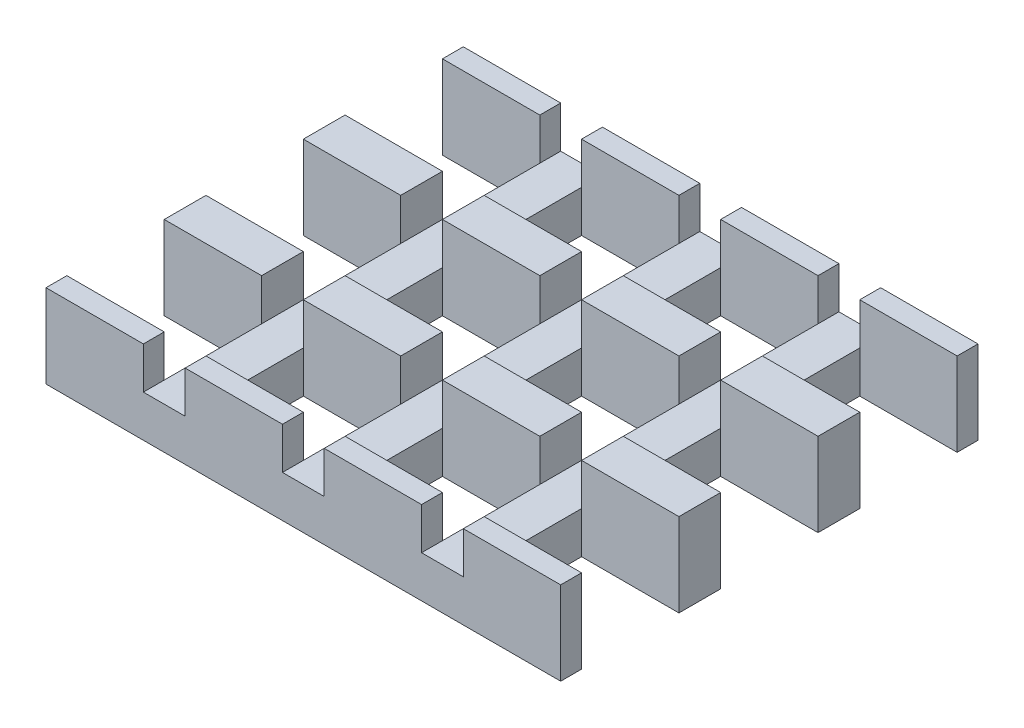
from build123d import *

# Parameters (mm, degrees)
SKETCH6_W            = 40
SKETCH6_H            = 30
BOSS_EXTRUDE1_DEPTH  = 6
SKETCH10_W           = 7
SKETCH10_H           = 7
CUT_EXTRUDE6_DEPTH   = 51.358713248
LPATTERN3_COUNT      = 3
LPATTERN3_PITCH      = 10
LPATTERN3_COUNT_DIR2 = 4
LPATTERN3_PITCH_DIR2 = 10
SKETCH11_W           = 3
SKETCH11_H           = 30
CUT_EXTRUDE7_DEPTH   = 3
LPATTERN4_COUNT      = 3
LPATTERN4_PITCH      = 10
SKETCH12_W           = 1.5
SKETCH12_H           = 30
CUT_EXTRUDE8_DEPTH   = 51.358713248


with BuildPart() as part:
    # Sketch6 → Boss-Extrude1 (new body)
    with BuildSketch(Plane(origin=(0, 0, 0), x_dir=(1, 0, 0), z_dir=(0, 1, 0))):
        with Locations((20, -15)):
            Rectangle(SKETCH6_W, SKETCH6_H)
    extrude(amount=BOSS_EXTRUDE1_DEPTH)

    # Sketch10 → Cut-Extrude6 (cut, through all)
    with BuildSketch(Plane(origin=(0, 6, 0), x_dir=(1, 0, 0), z_dir=(0, 1, 0))):
        with Locations((5, -5)):
            Rectangle(SKETCH10_W, SKETCH10_H)
    cut_extrude6 = extrude(amount=-CUT_EXTRUDE6_DEPTH, mode=Mode.SUBTRACT)

    # LPattern3: Cut-Extrude6 3 × 4
    with Locations(*[(j * LPATTERN3_PITCH_DIR2, 0, i * LPATTERN3_PITCH) for i in range(LPATTERN3_COUNT) for j in range(LPATTERN3_COUNT_DIR2) if (i, j) != (0, 0)]):
        add(cut_extrude6, mode=Mode.SUBTRACT)

    # Sketch11 → Cut-Extrude7 (cut)
    with BuildSketch(Plane(origin=(0, 6, 0), x_dir=(1, 0, 0), z_dir=(0, 1, 0))):
        with Locations((10, -15)):
            Rectangle(SKETCH11_W, SKETCH11_H)
    cut_extrude7 = extrude(amount=-CUT_EXTRUDE7_DEPTH, mode=Mode.SUBTRACT)

    # LPattern4: Cut-Extrude7 ×3
    with Locations(*[(i * LPATTERN4_PITCH, 0, 0) for i in range(1, LPATTERN4_COUNT)]):
        add(cut_extrude7, mode=Mode.SUBTRACT)

    # Sketch12 → Cut-Extrude8 (cut, through all)
    with BuildSketch(Plane(origin=(0, 6, 0), x_dir=(1, 0, 0), z_dir=(0, 1, 0))):
        with Locations((0.75, -15)):
            Rectangle(SKETCH12_W, SKETCH12_H)
        with Locations((39.25, -15)):
            Rectangle(SKETCH12_W, SKETCH12_H)
    extrude(amount=-CUT_EXTRUDE8_DEPTH, mode=Mode.SUBTRACT)


solid = part.part
